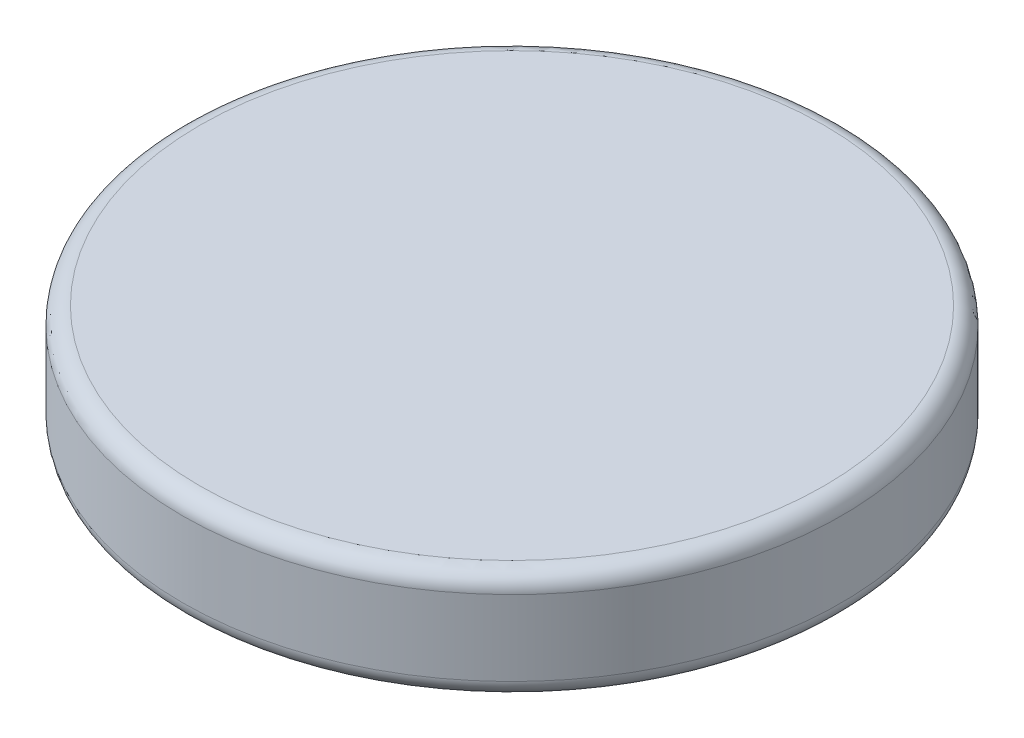
from build123d import *

# Parameters (mm, degrees)
SKETCH1_R           = 4.7625
BOSS_EXTRUDE1_DEPTH = 1.5875
FILLET1_R           = 0.25


with BuildPart() as part:
    # Sketch1 → Boss-Extrude1 (new body)
    with BuildSketch(Plane(origin=(0, 0, 0), x_dir=(1, 0, 0), z_dir=(0, 1, 0))):
        with Locations(Location((0, 0, 0), (0, 0, 270))):
            Circle(SKETCH1_R)
    extrude(amount=BOSS_EXTRUDE1_DEPTH)

    # Fillet1
    fillet1_edges = [part.edges().sort_by_distance(p)[0] for p in [
        (0, 0, -4.7625),
        (0, 1.5875, -4.7625),
    ]]
    fillet(fillet1_edges, radius=FILLET1_R)


solid = part.part
